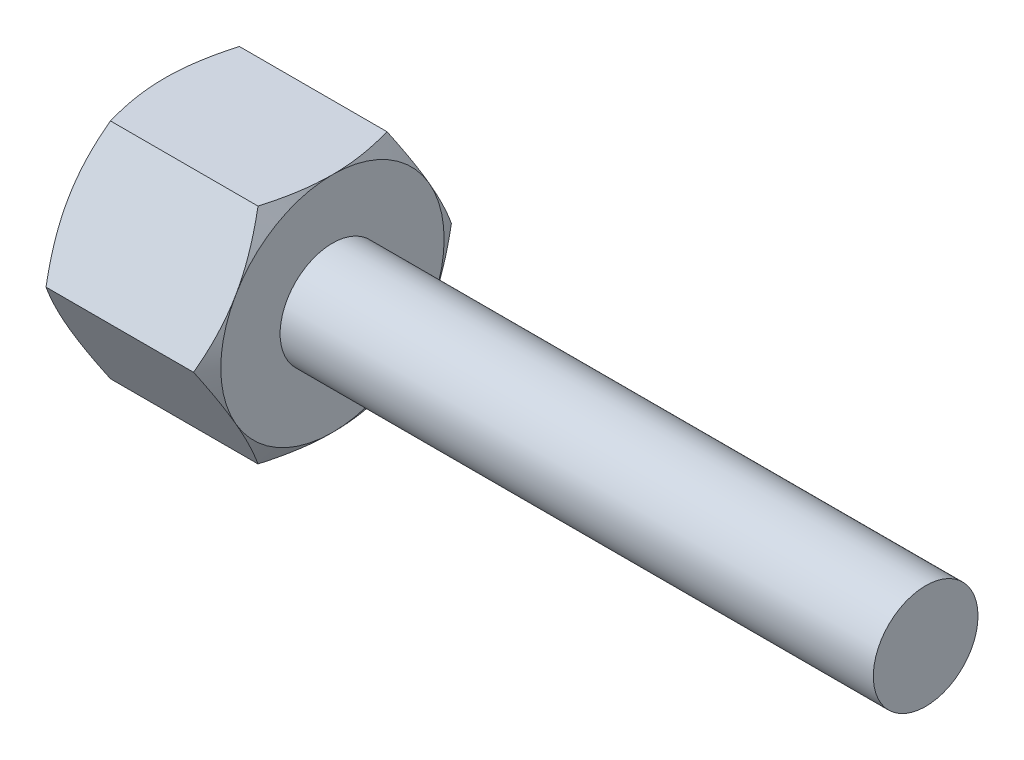
from build123d import *

# Parameters (mm, degrees)
Y_KSEKLIK_EKSTR_ZYON1_DEPTH = 6
IZIM2_R                     = 1.875
Y_KSEKLIK_EKSTR_ZYON2_DEPTH = 21.25
IZIM3_OUTSIDE_W             = 51.852
IZIM3_OUTSIDE_H             = 50.614
IZIM3_OUTSIDE_R             = 4
KES_EKSTR_ZYON1_DEPTH       = 10
KES_EKSTR_ZYON1_DRAFT       = -60
IZIM4_OUTSIDE_W             = 51.852
IZIM4_OUTSIDE_H             = 50.614
IZIM4_OUTSIDE_R             = 4
KES_EKSTR_ZYON2_DEPTH       = 10
KES_EKSTR_ZYON2_DRAFT       = -60


with BuildPart() as part:
    # Çizim1 → Yükseklik-Ekstrüzyon1 (new body)
    with BuildSketch(Plane(origin=(0, 0, 0), x_dir=(0, 0, -1), z_dir=(1, 0, 0))):
        Polygon((4.618802154, 0), (2.309401077, 4), (-2.309401077, 4), (-4.618802154, 0), (-2.309401077, -4), (2.309401077, -4), align=None)
    extrude(amount=Y_KSEKLIK_EKSTR_ZYON1_DEPTH)

    # Çizim2 → Yükseklik-Ekstrüzyon2 (add)
    with BuildSketch(Plane(origin=(6, 0, 0), x_dir=(0, 0, -1), z_dir=(1, 0, 0))):
        Circle(IZIM2_R)
    extrude(amount=Y_KSEKLIK_EKSTR_ZYON2_DEPTH)


with BuildPart() as kes_ekstr_zyon1_tool:
    # Çizim3 outside → Kes-Ekstrüzyon1 (with draft: the straight prism first)
    with BuildSketch(Plane(origin=(6, 0, 0), x_dir=(0, 0, -1), z_dir=(1, 0, 0))):
        Rectangle(IZIM3_OUTSIDE_W, IZIM3_OUTSIDE_H)
        Circle(IZIM3_OUTSIDE_R, mode=Mode.SUBTRACT)
    extrude(amount=-KES_EKSTR_ZYON1_DEPTH)
    # Kes-Ekstrüzyon1: the draft: its side faces are tilted about the plane it starts from
    kes_ekstr_zyon1_sides = [kes_ekstr_zyon1_tool.faces().sort_by_distance(p)[0] for p in [
        (1, -25.307, 0),
        (1, 0, -25.926),
        (1, 25.307, 0),
        (1, 0, 25.926),
        (1, 0, 4),
    ]]
    draft(kes_ekstr_zyon1_sides, Plane(origin=(6, 0, 0), x_dir=(0, 0, -1), z_dir=(1, 0, 0)), KES_EKSTR_ZYON1_DRAFT)


with BuildPart() as part_1:
    add(part.part)

    # Kes-Ekstrüzyon1: cut by kes_ekstr_zyon1_tool
    add(kes_ekstr_zyon1_tool.part, mode=Mode.SUBTRACT)


with BuildPart() as kes_ekstr_zyon2_tool:
    # Çizim4 outside → Kes-Ekstrüzyon2 (with draft: the straight prism first)
    with BuildSketch(Plane.ZY):
        Rectangle(IZIM4_OUTSIDE_W, IZIM4_OUTSIDE_H)
        Circle(IZIM4_OUTSIDE_R, mode=Mode.SUBTRACT)
    extrude(amount=-KES_EKSTR_ZYON2_DEPTH)
    # Kes-Ekstrüzyon2: the draft: its side faces are tilted about the plane it starts from
    kes_ekstr_zyon2_sides = [kes_ekstr_zyon2_tool.faces().sort_by_distance(p)[0] for p in [
        (5, -25.307, 0),
        (5, 0, 25.926),
        (5, 25.307, 0),
        (5, 0, -25.926),
        (5, 0, -4),
    ]]
    draft(kes_ekstr_zyon2_sides, Plane.ZY, KES_EKSTR_ZYON2_DRAFT)


with BuildPart() as part_2:
    add(part_1.part)

    # Kes-Ekstrüzyon2: cut by kes_ekstr_zyon2_tool
    add(kes_ekstr_zyon2_tool.part, mode=Mode.SUBTRACT)


solid = part_2.part
